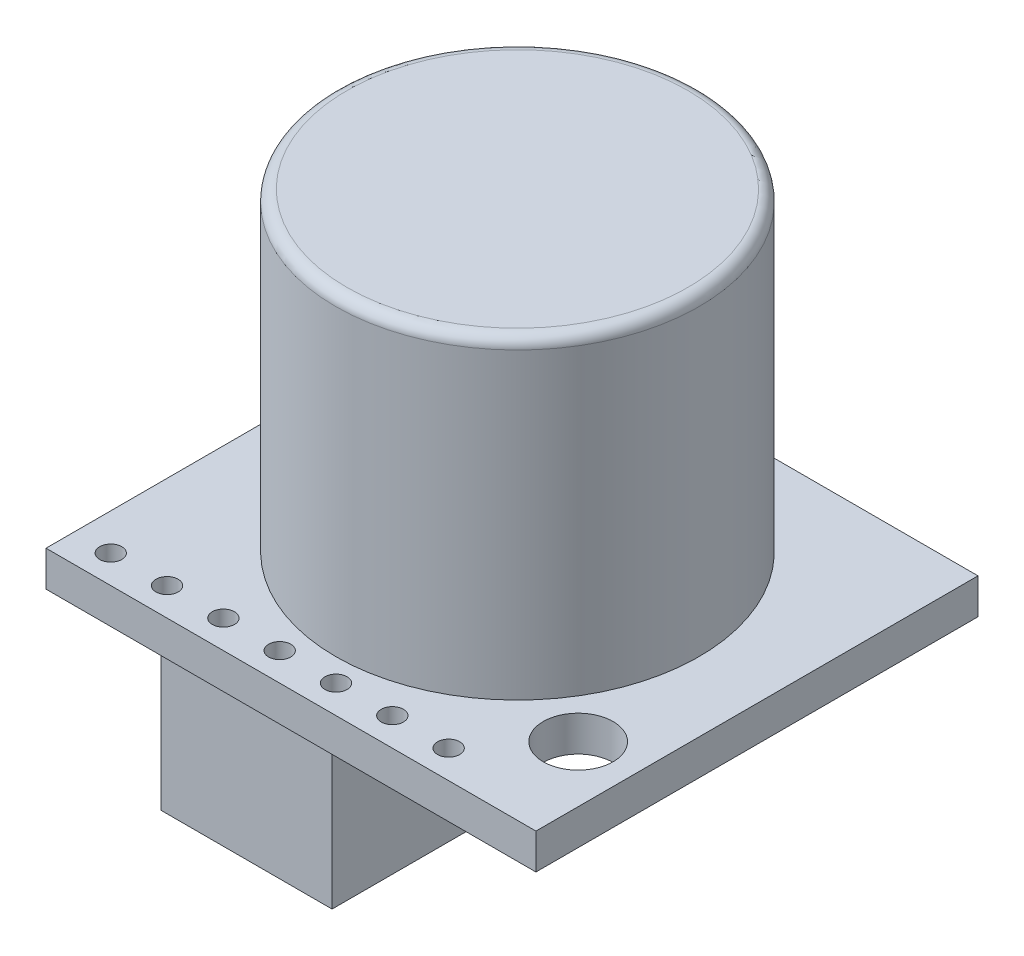
from build123d import *

# Parameters (mm, degrees)
SKETCH1_W           = 22.098
SKETCH1_H           = 19.939
SKETCH1_R           = 0.5
SKETCH1_R_2         = 1.5748
BOSS_EXTRUDE1_DEPTH = 1.6002
SKETCH1_3_W         = 7.7216
SKETCH1_3_H         = 7.7216
BOSS_EXTRUDE2_DEPTH = 9.3472
SKETCH1_4_R         = 8.1915
BOSS_EXTRUDE3_DEPTH = 15.7734
FILLET1_R           = 0.5


with BuildPart() as part:
    # Sketch1 → Boss-Extrude1 (new body)
    with BuildSketch(Plane(origin=(0, 0, 0), x_dir=(1, 0, 0), z_dir=(0, 1, 0))):
        with Locations((11.049, 9.9695)):
            Rectangle(SKETCH1_W, SKETCH1_H)
        with Locations((1.651, 1.27)):
            Circle(SKETCH1_R, mode=Mode.SUBTRACT)
        with Locations((4.191, 1.27)):
            Circle(SKETCH1_R, mode=Mode.SUBTRACT)
        with Locations((6.731, 1.27)):
            Circle(SKETCH1_R, mode=Mode.SUBTRACT)
        with Locations((9.271, 1.27)):
            Circle(SKETCH1_R, mode=Mode.SUBTRACT)
        with Locations((11.811, 1.27)):
            Circle(SKETCH1_R, mode=Mode.SUBTRACT)
        with Locations((14.351, 1.27)):
            Circle(SKETCH1_R, mode=Mode.SUBTRACT)
        with Locations((16.891, 1.27)):
            Circle(SKETCH1_R, mode=Mode.SUBTRACT)
        with Locations((19.558, 4.445)):
            Circle(SKETCH1_R_2, mode=Mode.SUBTRACT)
        with Locations((2.54, 17.399)):
            Circle(SKETCH1_R_2, mode=Mode.SUBTRACT)
    extrude(amount=BOSS_EXTRUDE1_DEPTH)

    # Sketch1<3> → Boss-Extrude2 (add)
    with BuildSketch(Plane(origin=(0, 0, 0), x_dir=(1, 0, 0), z_dir=(0, 1, 0))):
        with Locations((5.7404, 7.1628)):
            Rectangle(SKETCH1_3_W, SKETCH1_3_H)
    extrude(amount=-BOSS_EXTRUDE2_DEPTH)

    # Sketch1<4> → Boss-Extrude3 (add)
    with BuildSketch(Plane(origin=(0, 0, 0), x_dir=(1, 0, 0), z_dir=(0, 1, 0))):
        with Locations((10.774120393, 10.4902)):
            Circle(SKETCH1_4_R)
    extrude(amount=BOSS_EXTRUDE3_DEPTH)

    # Fillet1
    fillet1_edges = [part.edges().sort_by_distance(p)[0] for p in [
        (2.582620393, 15.7734, -10.4902),
    ]]
    fillet(fillet1_edges, radius=FILLET1_R)


solid = part.part
